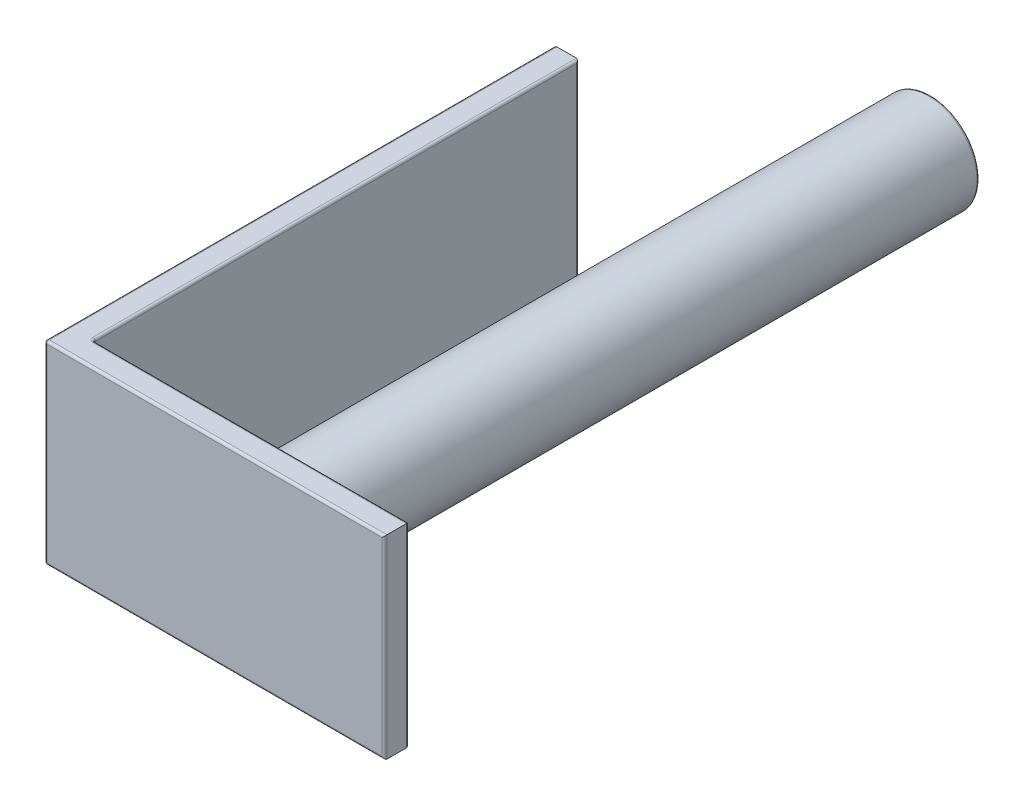
from build123d import *

# Parameters (mm, degrees)
SKETCH1_R           = 50.8
BOSS_EXTRUDE1_DEPTH = 711.2
EXTRUDE_THIN1_DEPTH = 101.6
FILLET1_R           = 2.54


with BuildPart() as part:
    # Sketch1 → Boss-Extrude1 (new body)
    with BuildSketch(Plane.XY):
        Circle(SKETCH1_R)
    extrude(amount=-BOSS_EXTRUDE1_DEPTH)

    # Sketch3 → Extrude-Thin1 (add, symmetric)
    with BuildSketch(Plane(origin=(0, 0, 0), x_dir=(1, 0, 0), z_dir=(0, 1, 0))):
        Polygon((165.1, 0), (-165.1, 0), (-165.1, 508), (-190.5, 508), (-190.5, -25.4), (165.1, -25.4), align=None)
    extrude(amount=EXTRUDE_THIN1_DEPTH, both=True)

    # Fillet1
    fillet1_edges = [part.edges().sort_by_distance(p)[0] for p in [
        (-50.8, 0, 0),
        (-50.8, 0, -711.2),
        (-165.1, -101.6, -254),
        (-165.1, 0, 0),
        (-165.1, 0, -508),
        (-190.5, 101.6, -241.3),
        (-190.5, 0, -508),
        (-12.7, 101.6, 25.4),
        (-190.5, 0, 25.4),
        (165.1, 0, 25.4),
        (0, -101.6, 0),
        (165.1, 0, 0),
        (-165.1, 101.6, -254),
        (0, 101.6, 0),
        (-12.7, -101.6, 25.4),
        (-190.5, -101.6, -241.3),
    ]]
    fillet(fillet1_edges, radius=FILLET1_R)


solid = part.part
